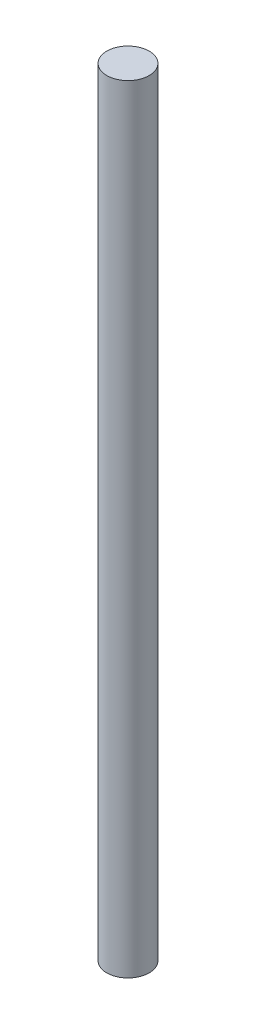
from build123d import *

# Parameters (mm, degrees)
SKETCH1_R           = 1.5
BOSS_EXTRUDE1_DEPTH = 55


with BuildPart() as part:
    # Sketch1 → Boss-Extrude1 (new body)
    with BuildSketch(Plane(origin=(0, 0, 0), x_dir=(1, 0, 0), z_dir=(0, 1, 0))):
        with Locations(Location((0, 0, 0), (0, 0, 270))):
            Circle(SKETCH1_R)
    extrude(amount=BOSS_EXTRUDE1_DEPTH)


solid = part.part
